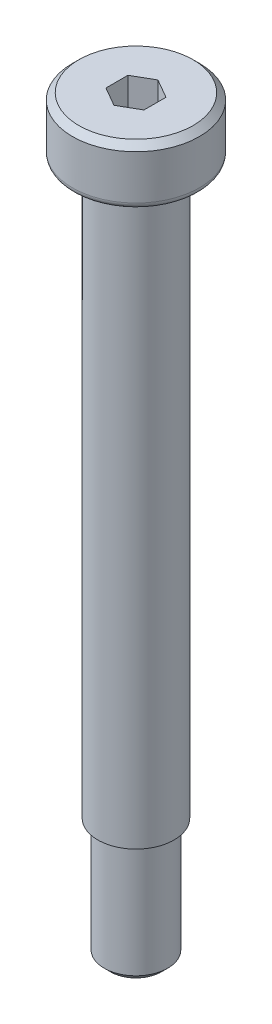
from build123d import *

# Parameters (mm, degrees)
CUT_EXTRUDE1_DEPTH = 2.4
CHAMFER1_SIZE      = 0.5
FILLET1_R          = 0.5
CHAMFER2_SIZE      = 0.5


with BuildPart() as part:
    # Sketch1 → Revolve1 (revolve)
    with BuildSketch(Plane.XY, mode=Mode.PRIVATE) as revolve1_sk:
        Polygon((0, 0), (5, 0), (5, -4.5), (2.75, -4.5), (2.75, -5), (3, -5), (3, -49.5), (2.5, -49.5), (2.5, -59), (0, -59), align=None)
    revolve(revolve1_sk.sketch.rotate(Axis((0, 5, 0), (0, -1, 0)), 180), axis=Axis((0, 5, 0), (0, -1, 0)))

    # Sketch2 → Cut-Extrude1 (cut)
    with BuildSketch(Plane(origin=(0, 0, 0), x_dir=(1, 0, 0), z_dir=(0, 1, 0))):
        Polygon((0, -1.732050808), (1.5, -0.866025404), (1.5, 0.866025404), (0, 1.732050808), (-1.5, 0.866025404), (-1.5, -0.866025404), align=None)
    extrude(amount=-CUT_EXTRUDE1_DEPTH, mode=Mode.SUBTRACT)

    # Chamfer1
    chamfer1_edges = [part.edges().sort_by_distance(p)[0] for p in [
        (5, 0, 0),
    ]]
    chamfer(chamfer1_edges, length=CHAMFER1_SIZE)

    # Fillet1
    fillet1_edges = [part.edges().sort_by_distance(p)[0] for p in [
        (5, -4.5, 0),
    ]]
    fillet(fillet1_edges, radius=FILLET1_R)

    # Chamfer2
    chamfer2_edges = [part.edges().sort_by_distance(p)[0] for p in [
        (2.5, -59, 0),
    ]]
    chamfer(chamfer2_edges, length=CHAMFER2_SIZE)


solid = part.part
